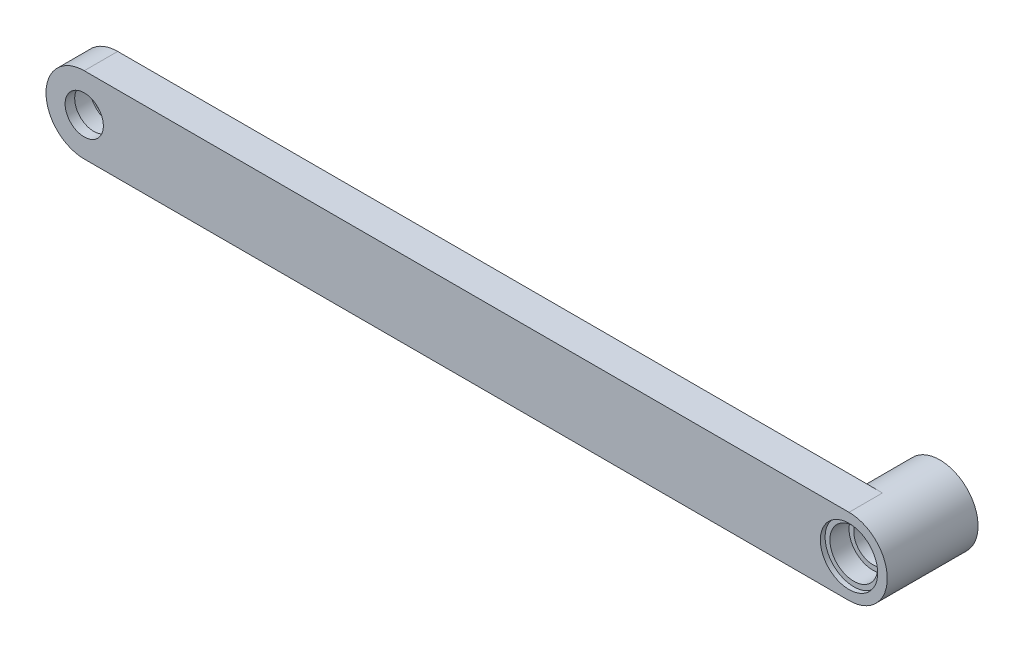
from build123d import *

# Parameters (mm, degrees)
EXTRUDE_1_DEPTH     = 3.5
SKETCH_4_R          = 2
CUT_EXTRUDE_1_DEPTH = 85.167986788
SKETCH_4_3_R        = 2.5
SKETCH_4_3_R_2      = 2
CUT_EXTRUDE_2_DEPTH = 2.5
SKETCH_4_5_R        = 3
SKETCH_4_5_R_2      = 2.5
CUT_EXTRUDE_4_DEPTH = 0.5
EXTRUDE_START       = 6
SKETCH_5_R          = 4
EXTRUDE_2_DEPTH     = 6
SKETCH_6_R          = 2
CUT_EXTRUDE_5_DEPTH = 85.630077396
SKETCH_6_3_R        = 2.5
SKETCH_6_3_R_2      = 2
CUT_EXTRUDE_6_DEPTH = 2.5
SKETCH_6_4_R        = 3
SKETCH_6_4_R_2      = 2.5
CUT_EXTRUDE_7_DEPTH = 0.5
CUT_EXTRUDE_START   = -2.5
SKETCH_7_R          = 2.5
CUT_EXTRUDE_8_DEPTH = 2.5
CUT_EXTRUDE_START_2 = -0.5
SKETCH_7_3_R        = 3
SKETCH_7_3_R_2      = 2.5
CUT_EXTRUDE_9_DEPTH = 0.5


with BuildPart() as part:
    # 草图3 → 凸台-拉伸1 (new body)
    with BuildSketch(Plane.XY):
        with BuildLine():
            Line((0, 4), (80, 4))
            ThreePointArc((80, 4), (84, 0), (80, -4))
            Line((80, -4), (0, -4))
            ThreePointArc((0, -4), (-4, 0), (0, 4))
        make_face()
    extrude(amount=EXTRUDE_1_DEPTH)

    # 草图4 → 切除-拉伸1 (cut, through all)
    with BuildSketch(Plane(origin=(0, 0, 0), x_dir=(-1, 0, 0), z_dir=(0, 0, -1))):
        Circle(SKETCH_4_R)
    extrude(amount=-CUT_EXTRUDE_1_DEPTH, mode=Mode.SUBTRACT)

    # 草图4<3> → 切除-拉伸2 (cut)
    with BuildSketch(Plane(origin=(0, 0, 0), x_dir=(-1, 0, 0), z_dir=(0, 0, -1))):
        Circle(SKETCH_4_3_R)
        Circle(SKETCH_4_3_R_2, mode=Mode.SUBTRACT)
    extrude(amount=-CUT_EXTRUDE_2_DEPTH, mode=Mode.SUBTRACT)

    # 草图4<5> → 切除-拉伸4 (cut)
    with BuildSketch(Plane(origin=(0, 0, 0), x_dir=(-1, 0, 0), z_dir=(0, 0, -1))):
        Circle(SKETCH_4_5_R)
        Circle(SKETCH_4_5_R_2, mode=Mode.SUBTRACT)
    extrude(amount=-CUT_EXTRUDE_4_DEPTH, mode=Mode.SUBTRACT)

    # 草图5 → 凸台-拉伸2 (add)
    with BuildSketch(Plane(origin=(0, 0, 0), x_dir=(-1, 0, 0), z_dir=(0, 0, -1)).offset(EXTRUDE_START)):
        with Locations((-80, 0)):
            Circle(SKETCH_5_R)
    extrude(amount=-EXTRUDE_2_DEPTH)

    # 草图6 → 切除-拉伸5 (cut, through all)
    with BuildSketch(Plane(origin=(0, 0, -6), x_dir=(-1, 0, 0), z_dir=(0, 0, -1))):
        with Locations((-80, 0)):
            Circle(SKETCH_6_R)
    extrude(amount=-CUT_EXTRUDE_5_DEPTH, mode=Mode.SUBTRACT)

    # 草图6<3> → 切除-拉伸6 (cut)
    with BuildSketch(Plane(origin=(0, 0, -6), x_dir=(-1, 0, 0), z_dir=(0, 0, -1))):
        with Locations((-80, 0)):
            Circle(SKETCH_6_3_R)
        with Locations((-80, 0)):
            Circle(SKETCH_6_3_R_2, mode=Mode.SUBTRACT)
    extrude(amount=-CUT_EXTRUDE_6_DEPTH, mode=Mode.SUBTRACT)

    # 草图6<4> → 切除-拉伸7 (cut)
    with BuildSketch(Plane(origin=(0, 0, -6), x_dir=(-1, 0, 0), z_dir=(0, 0, -1))):
        with Locations((-80, 0)):
            Circle(SKETCH_6_4_R)
        with Locations((-80, 0)):
            Circle(SKETCH_6_4_R_2, mode=Mode.SUBTRACT)
    extrude(amount=-CUT_EXTRUDE_7_DEPTH, mode=Mode.SUBTRACT)

    # 草图7 → 切除-拉伸8 (cut)
    with BuildSketch(Plane.XY.offset(3.5).offset(CUT_EXTRUDE_START)):
        with Locations((80, 0)):
            Circle(SKETCH_7_R)
    extrude(amount=CUT_EXTRUDE_8_DEPTH, mode=Mode.SUBTRACT)

    # 草图7<3> → 切除-拉伸9 (cut)
    with BuildSketch(Plane.XY.offset(3.5).offset(CUT_EXTRUDE_START_2)):
        with Locations((80, 0)):
            Circle(SKETCH_7_3_R)
        with Locations((80, 0)):
            Circle(SKETCH_7_3_R_2, mode=Mode.SUBTRACT)
    extrude(amount=CUT_EXTRUDE_9_DEPTH, mode=Mode.SUBTRACT)


solid = part.part
